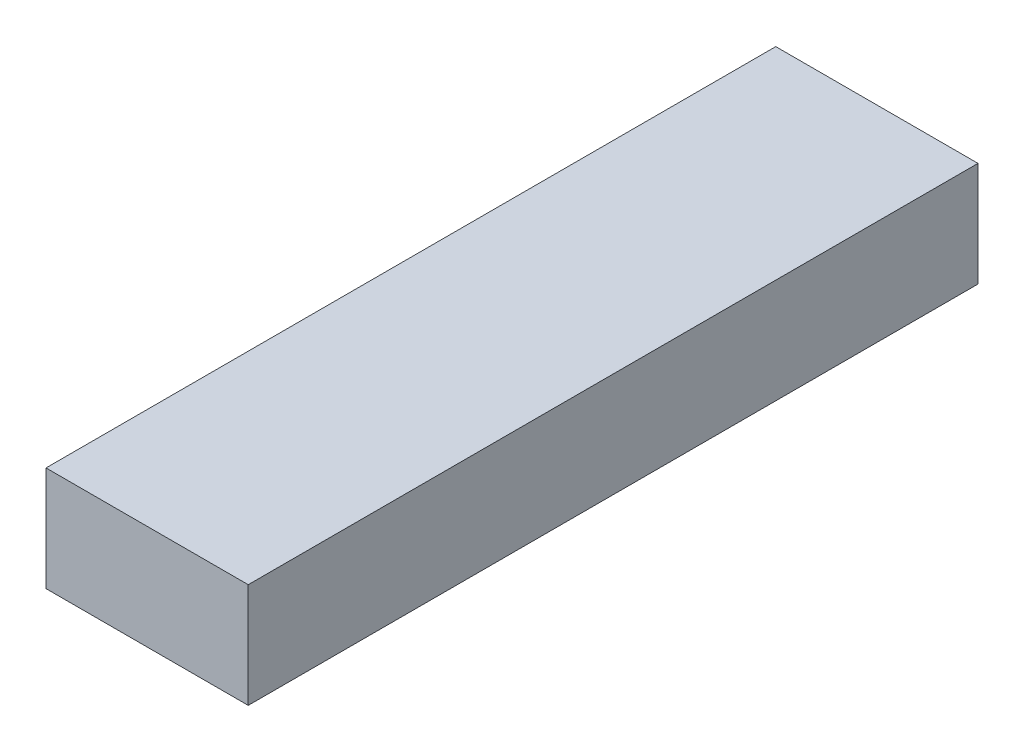
from build123d import *

# Parameters (mm, degrees)
SKETCH1_W           = 19.345068399
SKETCH1_H           = 69.804582473
BOSS_EXTRUDE1_DEPTH = 10
SCALE1_SCALE        = 0.7


with BuildPart() as part:
    # Sketch1 → Boss-Extrude1 (new body)
    with BuildSketch(Plane(origin=(0, 0, 0), x_dir=(1, 0, 0), z_dir=(0, 1, 0))):
        with Locations((-9.6725342, -1.352801985)):
            Rectangle(SKETCH1_W, SKETCH1_H)
    extrude(amount=BOSS_EXTRUDE1_DEPTH)


with BuildPart() as part_1:
    # Scale1: scaled about (-9.672534199, 5, 1.352801986)
    add(part.part.scale(SCALE1_SCALE).moved(Location((-2.90176026, 1.5, 0.405840596))))


solid = part_1.part
